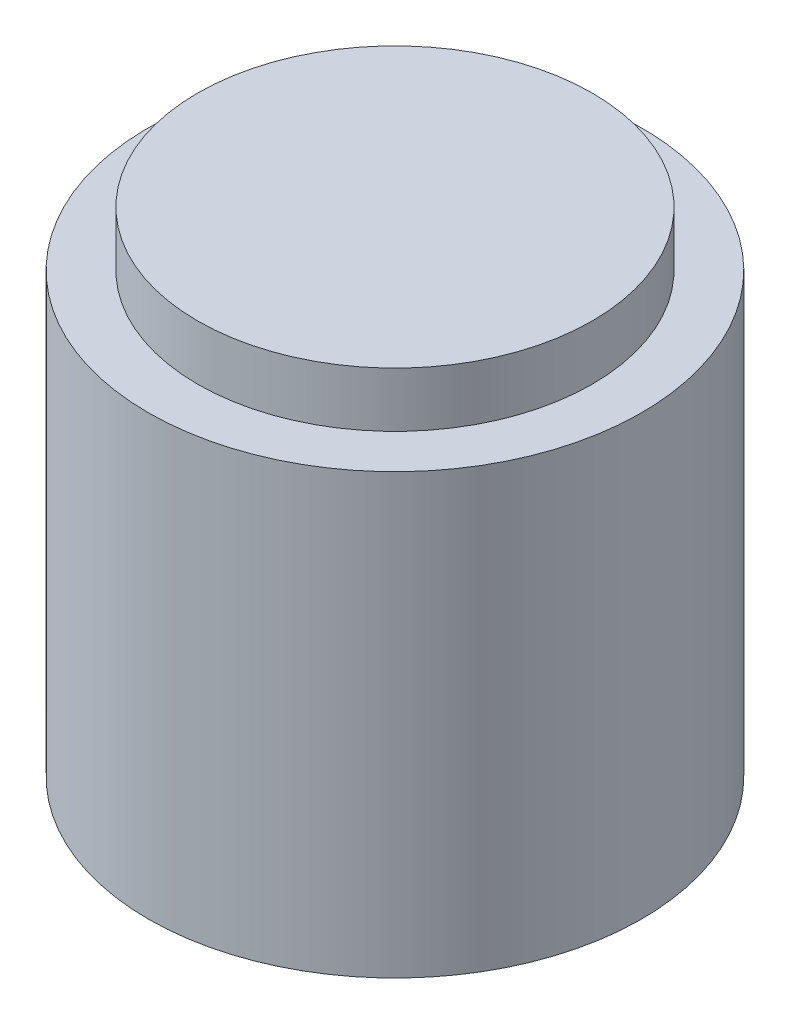
from build123d import *

# Parameters (mm, degrees)
SKETCH1_R                       = 7.14375
BOSS_EXTRUDE1_DEPTH             = 12.7
SKETCH3_R                       = 5.715
BOSS_EXTRUDE2_DEPTH             = 1.5875
F_1_4_0_25_DIAMETER_HOLE1_D     = 6.35
F_1_4_0_25_DIAMETER_HOLE1_DEPTH = 11.1125
F_1_4_0_25_DIAMETER_HOLE1_TIP   = 1.907732465


with BuildPart() as part:
    # Sketch1 → Boss-Extrude1 (new body)
    with BuildSketch(Plane(origin=(0, 0, 0), x_dir=(1, 0, 0), z_dir=(0, 1, 0))):
        with Locations(Location((0, 0, 0), (0, 0, 270))):
            Circle(SKETCH1_R)
    extrude(amount=BOSS_EXTRUDE1_DEPTH)

    # Sketch3 → Boss-Extrude2 (add)
    with BuildSketch(Plane(origin=(0, 12.7, 0), x_dir=(1, 0, 0), z_dir=(0, 1, 0))):
        with Locations(Location((0, 0, 0), (0, 0, 270))):
            Circle(SKETCH3_R)
    extrude(amount=BOSS_EXTRUDE2_DEPTH)

    # 1/4 (0.25) Diameter Hole1
    with Locations(Plane(origin=(0, 0, 0), x_dir=(-1, 0, 0), z_dir=(0, -1, 0))):
        with Locations((0, 0)):
            Hole(F_1_4_0_25_DIAMETER_HOLE1_D / 2, depth=F_1_4_0_25_DIAMETER_HOLE1_DEPTH)
            with Locations((0, 0, -(F_1_4_0_25_DIAMETER_HOLE1_DEPTH + F_1_4_0_25_DIAMETER_HOLE1_TIP / 2))):  # 118° drill point
                Cone(0, F_1_4_0_25_DIAMETER_HOLE1_D / 2, F_1_4_0_25_DIAMETER_HOLE1_TIP, mode=Mode.SUBTRACT)


solid = part.part
